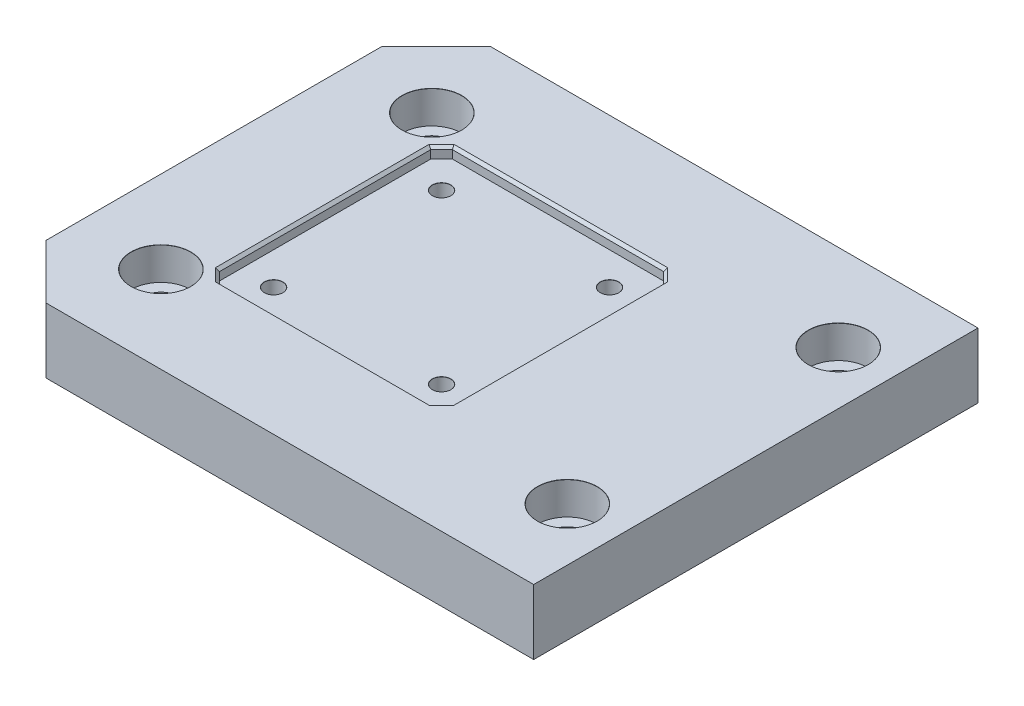
from build123d import *

# Parameters (mm, degrees)
BOSS_EXTRUDE1_DEPTH           = 12
CBORE_FOR_M6_SHCS1_AT_2_COUNT = 2
CBORE_FOR_M6_SHCS1_AT_2_PITCH = 50
CBORE_FOR_M6_SHCS1_AT_3_COUNT = 2
CBORE_FOR_M6_SHCS1_AT_3_PITCH = 90.138781887
CBORE_FOR_M6_SHCS1_AT_4_COUNT = 2
CBORE_FOR_M6_SHCS1_AT_4_PITCH = 75
CUT_EXTRUDE3_DEPTH            = 2
CBORE_FOR_M3_SHCS1_AT_2_COUNT = 2
CBORE_FOR_M3_SHCS1_AT_2_PITCH = 31
CBORE_FOR_M3_SHCS1_AT_3_COUNT = 2
CBORE_FOR_M3_SHCS1_AT_3_PITCH = 43.840620434
CBORE_FOR_M3_SHCS1_AT_4_COUNT = 2
CBORE_FOR_M3_SHCS1_AT_4_PITCH = 31
CHAMFER1_SIZE                 = 0.5
CHAMFER2_SIZE                 = 10


with BuildPart() as part:
    # Sketch1 → Boss-Extrude1 (new body)
    with BuildSketch(Plane(origin=(0, 0, 0), x_dir=(1, 0, 0), z_dir=(0, 1, 0))):
        Polygon((58, 41), (0, 41), (-42, 41), (-42, -41), (0, -41), (58, -41), align=None)
    extrude(amount=BOSS_EXTRUDE1_DEPTH)

    # Sketch14 → CBORE for M6 SHCS1 (revolve, cut)
    with BuildSketch(Plane(origin=(48.21, 12, -25), x_dir=(0, 0, 1), z_dir=(1, 0, 0))):
        Polygon((0, 0), (0, 12), (3.325, 12), (3.3, 11.975), (3.3, 6), (5.5, 6), (5.5, 0.025), (5.525, 0), align=None)
    cbore_for_m6_shcs1 = revolve(axis=Axis((48.21, 18.35, -25), (0, -1, 0)), mode=Mode.SUBTRACT)

    # CBORE for M6 SHCS1 at 2: CBORE for M6 SHCS1 ×2
    with Locations(*[(0, 0, i * CBORE_FOR_M6_SHCS1_AT_2_PITCH) for i in range(1, CBORE_FOR_M6_SHCS1_AT_2_COUNT)]):
        add(cbore_for_m6_shcs1, mode=Mode.SUBTRACT)

    # CBORE for M6 SHCS1 at 3: CBORE for M6 SHCS1 ×2
    with Locations(*[Vector(-0.8320502943378437, 0, 0.5547001962252291) * (i * CBORE_FOR_M6_SHCS1_AT_3_PITCH) for i in range(1, CBORE_FOR_M6_SHCS1_AT_3_COUNT)]):
        add(cbore_for_m6_shcs1, mode=Mode.SUBTRACT)

    # CBORE for M6 SHCS1 at 4: CBORE for M6 SHCS1 ×2
    with Locations(*[(-i * CBORE_FOR_M6_SHCS1_AT_4_PITCH, 0, 0) for i in range(1, CBORE_FOR_M6_SHCS1_AT_4_COUNT)]):
        add(cbore_for_m6_shcs1, mode=Mode.SUBTRACT)

    # Sketch9 → Cut-Extrude3 (cut)
    with BuildSketch(Plane(origin=(0, 12, 0), x_dir=(1, 0, 0), z_dir=(0, 1, 0))):
        Polygon((21.5, 19.5), (19.5, 21.5), (-19.5, 21.5), (-21.5, 19.5), (-21.5, -19.5), (-19.5, -21.5), (19.5, -21.5), (21.5, -19.5), align=None)
    extrude(amount=-CUT_EXTRUDE3_DEPTH, mode=Mode.SUBTRACT)

    # Sketch12 → CBORE for M3 SHCS1 (revolve, cut)
    with BuildSketch(Plane(origin=(-15.5, 0, -15.5), x_dir=(0, 0, -1), z_dir=(1, 0, 0))):
        Polygon((0, 0), (0, 10), (1.725, 10), (1.7, 9.975), (1.7, 3), (3.25, 3), (3.25, 0.025), (3.275, 0), align=None)
    cbore_for_m3_shcs1 = revolve(axis=Axis((-15.5, -6.35, -15.5), (0, 1, 0)), mode=Mode.SUBTRACT)

    # CBORE for M3 SHCS1 at 2: CBORE for M3 SHCS1 ×2
    with Locations(*[(i * CBORE_FOR_M3_SHCS1_AT_2_PITCH, 0, 0) for i in range(1, CBORE_FOR_M3_SHCS1_AT_2_COUNT)]):
        add(cbore_for_m3_shcs1, mode=Mode.SUBTRACT)

    # CBORE for M3 SHCS1 at 3: CBORE for M3 SHCS1 ×2
    with Locations(*[Vector(0.7071067811865476, 0, 0.7071067811865475) * (i * CBORE_FOR_M3_SHCS1_AT_3_PITCH) for i in range(1, CBORE_FOR_M3_SHCS1_AT_3_COUNT)]):
        add(cbore_for_m3_shcs1, mode=Mode.SUBTRACT)

    # CBORE for M3 SHCS1 at 4: CBORE for M3 SHCS1 ×2
    with Locations(*[(0, 0, i * CBORE_FOR_M3_SHCS1_AT_4_PITCH) for i in range(1, CBORE_FOR_M3_SHCS1_AT_4_COUNT)]):
        add(cbore_for_m3_shcs1, mode=Mode.SUBTRACT)

    # Chamfer1
    chamfer1_edges = [part.edges().sort_by_distance(p)[0] for p in [
        (0, 12, -21.5),
        (21.5, 12, 0),
        (-20.5, 12, -20.5),
        (-21.5, 12, 0),
        (-20.5, 12, 20.5),
        (0, 12, 21.5),
        (20.5, 12, 20.5),
        (20.5, 12, -20.5),
    ]]
    chamfer(chamfer1_edges, length=CHAMFER1_SIZE)

    # Chamfer2
    chamfer2_edges = [part.edges().sort_by_distance(p)[0] for p in [
        (-42, 6, 41),
        (-42, 6, -41),
    ]]
    chamfer(chamfer2_edges, length=CHAMFER2_SIZE)


solid = part.part
